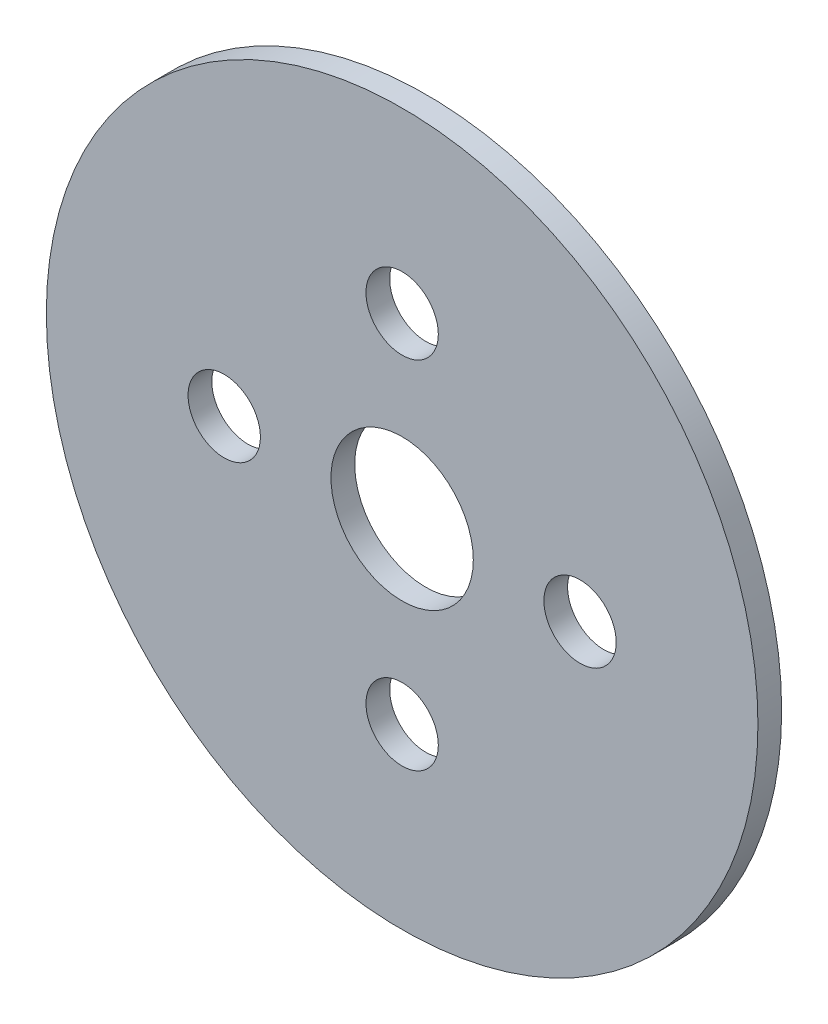
from build123d import *

# Parameters (mm, degrees)
SKETCH_1_R          = 15
SKETCH_1_R_2        = 1.525
EXTRUDE_1_DEPTH     = 1
SKETCH_3_R          = 3
CUT_EXTRUDE_2_DEPTH = 1


with BuildPart() as part:
    # 草图1 → 凸台-拉伸1 (new body)
    with BuildSketch(Plane.XY):
        Circle(SKETCH_1_R)
        with Locations((0, 7.5)):
            Circle(SKETCH_1_R_2, mode=Mode.SUBTRACT)
        with Locations((7.5, 0)):
            Circle(SKETCH_1_R_2, mode=Mode.SUBTRACT)
        with Locations((0, -7.5)):
            Circle(SKETCH_1_R_2, mode=Mode.SUBTRACT)
        with Locations((-7.5, 0)):
            Circle(SKETCH_1_R_2, mode=Mode.SUBTRACT)
    extrude(amount=EXTRUDE_1_DEPTH)

    # 草图3 → 切除-拉伸2 (cut)
    with BuildSketch(Plane.XY.offset(1)):
        Circle(SKETCH_3_R)
    extrude(amount=-CUT_EXTRUDE_2_DEPTH, mode=Mode.SUBTRACT)


solid = part.part
